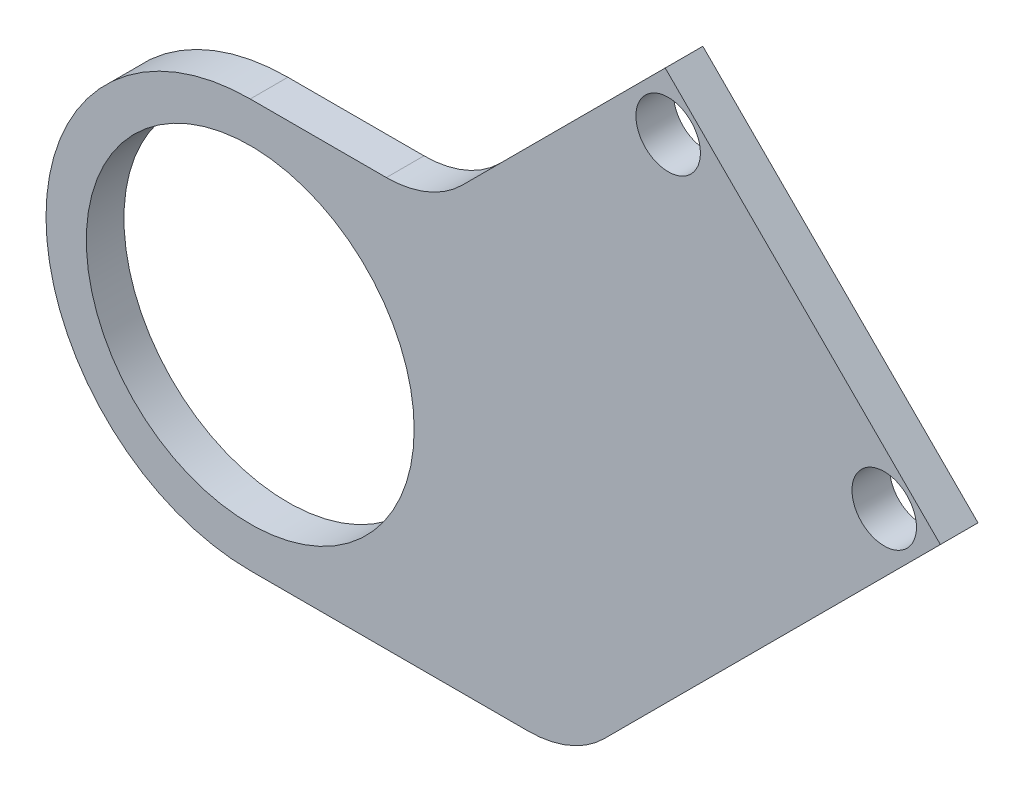
from build123d import *

# Parameters (mm, degrees)
SKETCH1_R           = 2.5
BOSS_EXTRUDE1_DEPTH = 3.5
SKETCH2_R           = 1.5
CUT_EXTRUDE1_DEPTH  = 77.148499601
FILLET1_R           = 10
SKETCH3_R           = 15.25
SKETCH3_R_2         = 3
CUT_EXTRUDE2_DEPTH  = 77.148499601


with BuildPart() as part:
    # Sketch1 → Boss-Extrude1 (new body)
    with BuildSketch(Plane.XY):
        with BuildLine():
            Line((0, -19), (30, -19))
            Line((30, -19), (64.201367261, 15.201367261))
            Line((64.201367261, 15.201367261), (58.615223689, 20.787510832))
            Line((58.615223689, 20.787510832), (44.190245353, 35.212489168))
            Line((44.190245353, 35.212489168), (38.604101782, 40.798632739))
            Line((38.604101782, 40.798632739), (16.805469042, 19))
            Line((16.805469042, 19), (0, 19))
            ThreePointArc((0, 19), (-19, 0), (0, -19))
        make_face()
        Circle(SKETCH1_R, mode=Mode.SUBTRACT)
    extrude(amount=BOSS_EXTRUDE1_DEPTH)

    # Sketch2 → Cut-Extrude1 (cut, through all)
    with BuildSketch(Plane.XY.offset(3.5)):
        with Locations((38.878105659, 35.574881393)):
            Circle(SKETCH2_R)
        with Locations((58.977615915, 15.475371138)):
            Circle(SKETCH2_R)
    extrude(amount=-CUT_EXTRUDE1_DEPTH, mode=Mode.SUBTRACT)

    # Fillet1
    fillet1_edges = [part.edges().sort_by_distance(p)[0] for p in [
        (16.805469042, 19, 1.75),
        (30, -19, 1.75),
    ]]
    fillet(fillet1_edges, radius=FILLET1_R)

    # Sketch3 → Cut-Extrude2 (cut, through all)
    with BuildSketch(Plane.XY.offset(3.5)):
        Circle(SKETCH3_R)
        with Locations((38.878105659, 35.574881393)):
            Circle(SKETCH3_R_2)
        with Locations((58.977615915, 15.475371138)):
            Circle(SKETCH3_R_2)
    extrude(amount=-CUT_EXTRUDE2_DEPTH, mode=Mode.SUBTRACT)


solid = part.part
